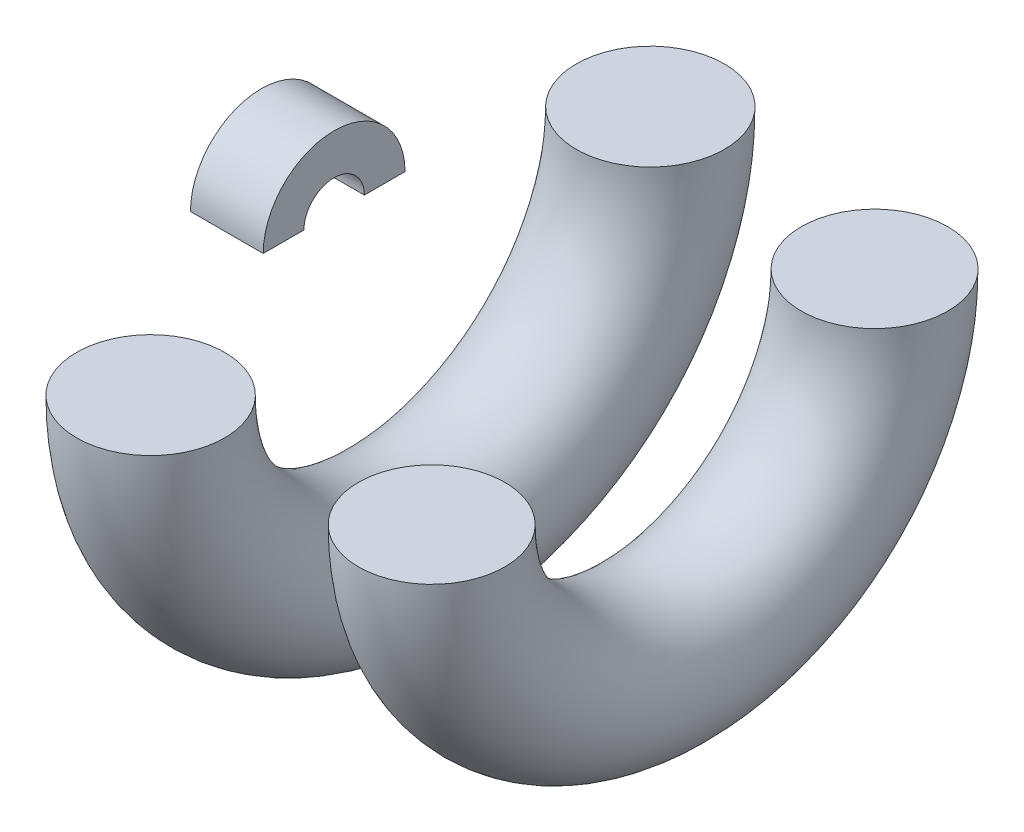
from build123d import *
from build123d.topology import SkipClean

# Parameters (mm, degrees)
SKETCH1_R      = 106.799061057
SKETCH1_R_2    = 108.062331866
SKETCH1_W      = 106.176655489
SKETCH1_H      = 59.382304745
REVOLVE1_ANGLE = 180


with BuildPart() as part:
    # Sketch1 → Revolve1 (revolve, symmetric)
    with SkipClean():  # the faces are left unmerged after this step: merging them gives an invalid solid
        with BuildSketch(Plane.XY) as revolve1_sk:
            with Locations((631.19867985, -376.148374897)):
                Circle(SKETCH1_R)
            with Locations((262.645080015, -417.567645482)):
                Circle(SKETCH1_R_2)
            with Locations((112.744283664, 20.660663633)):
                Rectangle(SKETCH1_W, SKETCH1_H)
        revolve(axis=Axis((0, -53.088327745, 0), (1, 0, 0)), revolution_arc=REVOLVE1_ANGLE / 2)
        revolve(revolve1_sk.sketch, axis=Axis((0, -53.088327745, 0), (-1, 0, 0)), revolution_arc=REVOLVE1_ANGLE / 2)


solid = part.part
